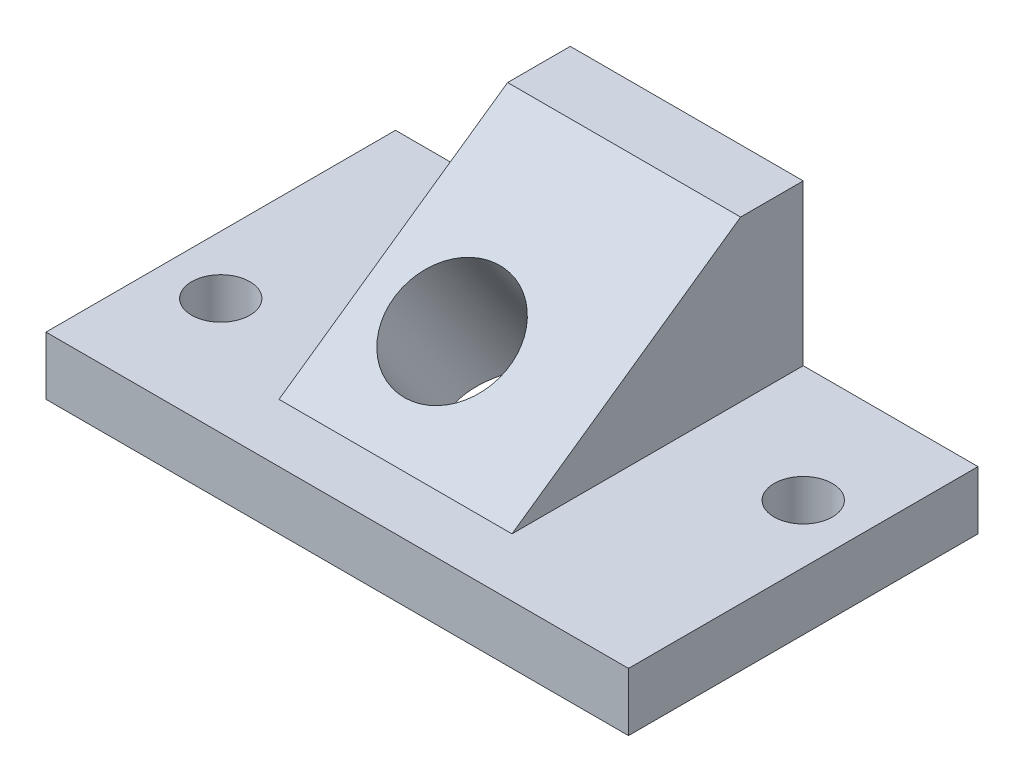
from build123d import *

# Parameters (mm, degrees)
SKETCH1_W           = 127
SKETCH1_H           = 76.2
BASE_EXTRUDE_DEPTH  = 12.7
BOSS_EXTRUDE2_DEPTH = 25.4
SKETCH4_R           = 6.35
CUT_EXTRUDE1_DEPTH  = 143.275747443
SKETCH5_R           = 12.7
CUT_EXTRUDE2_DEPTH  = 87.702150572


with BuildPart() as part:
    # Sketch1 → Base-Extrude (new body)
    with BuildSketch(Plane(origin=(0, 0, 0), x_dir=(1, 0, 0), z_dir=(0, 1, 0))):
        Rectangle(SKETCH1_W, SKETCH1_H)
    extrude(amount=BASE_EXTRUDE_DEPTH)

    # Sketch3 → Boss-Extrude2 (add, symmetric)
    with BuildSketch(Plane(origin=(0, 0, 0), x_dir=(0, 0, -1), z_dir=(1, 0, 0))):
        Polygon((-25.4, 12.7), (24.442365435, 47.6), (38.1, 47.6), (38.1, 12.7), align=None)
    extrude(amount=BOSS_EXTRUDE2_DEPTH, both=True)

    # Sketch4 → Cut-Extrude1 (cut, through all)
    with BuildSketch(Plane(origin=(65.699574279, 12.7, 10.189215324), x_dir=(-1, 0, 0), z_dir=(0, 1, 0))):
        with Locations(Location((14.899574279, -22.889215324, 0), (0, 0, 90))):
            Circle(SKETCH4_R)
        with Locations(Location((116.499574279, 2.510784676, 0), (0, 0, 90))):
            Circle(SKETCH4_R)
    extrude(amount=-CUT_EXTRUDE1_DEPTH, mode=Mode.SUBTRACT)

    # Sketch5 → Cut-Extrude2 (cut, through all)
    with BuildSketch(Plane(origin=(0, 20.455924194, 14.323392322), x_dir=(-1, 0, 0), z_dir=(0, 0.8191520442889948, 0.5735764363510417))):
        with Locations(Location((6.3, -9.224251984, 0), (0, 0, 90))):
            Circle(SKETCH5_R)
    extrude(amount=-CUT_EXTRUDE2_DEPTH, mode=Mode.SUBTRACT)


solid = part.part
